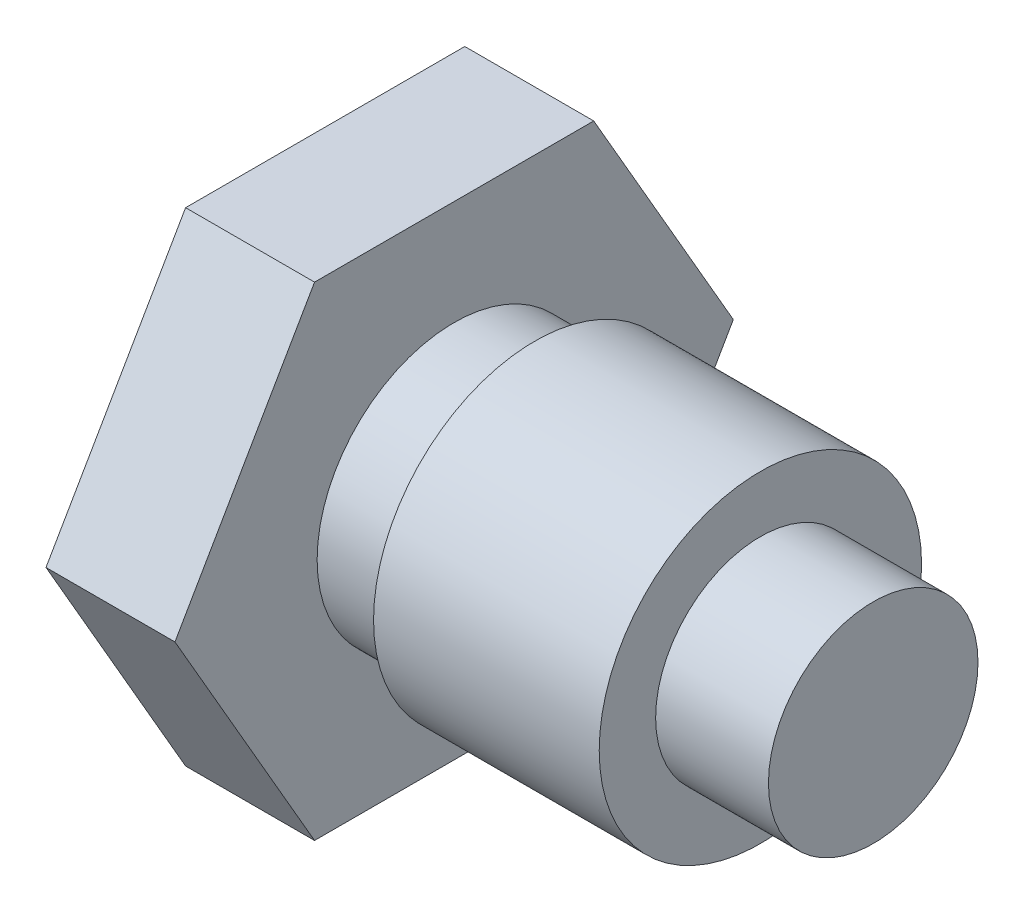
from build123d import *

# Parameters (mm, degrees)
F_01_HEX_AF30_DEPTH = 8


with BuildPart() as part:
    # 草图1 → 01_HEX_AF30 (new body)
    with BuildSketch(Plane(origin=(0, 0, 0), x_dir=(0, 0, -1), z_dir=(1, 0, 0))):
        Polygon((17.3205, 0), (8.66025, 14.999993006), (-8.66025, 14.999993006), (-17.3205, 0), (-8.66025, -14.999993006), (8.66025, -14.999993006), align=None)
    extrude(amount=F_01_HEX_AF30_DEPTH)

    # 草图2 → 02_BODY (revolve)
    with BuildSketch(Plane.XY, mode=Mode.PRIVATE) as f_02_body_sk:
        Polygon((8, 0), (8, 8.5), (13, 8.5), (13, 10), (27, 10), (27, 6.5), (34, 6.5), (34, 0), align=None)
    revolve(f_02_body_sk.sketch.rotate(Axis((3, 0, 0), (1, 0, 0)), 90), axis=Axis((3, 0, 0), (1, 0, 0)))


solid = part.part
